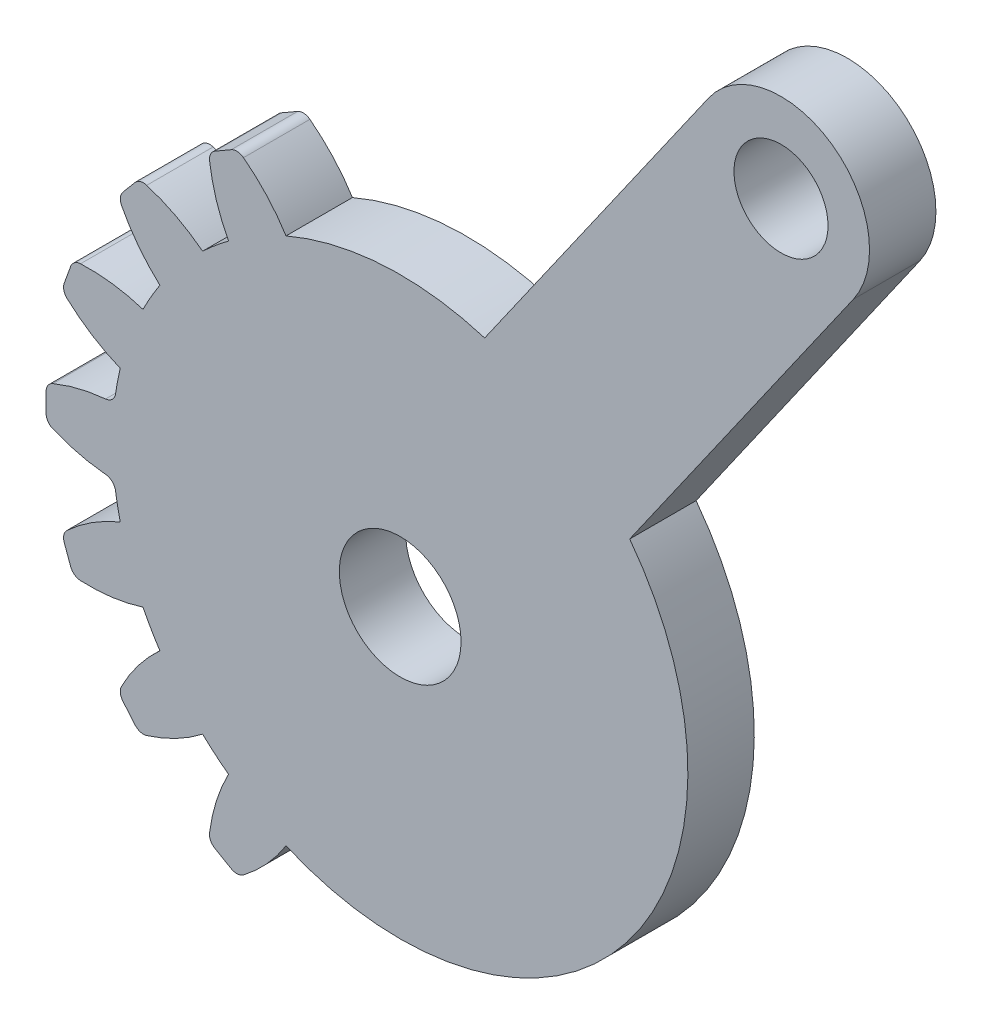
from build123d import *

# Parameters (mm, degrees)
SKETCH1_R           = 13
SKETCH1_R_2         = 2.75
BOSS_EXTRUDE1_DEPTH = 3
BOSS_EXTRUDE2_START = -3
BOSS_EXTRUDE2_DEPTH = 3
FILLET1_R           = 0.5
CIRPATTERN1_COUNT   = 4
CIRPATTERN1_ANGLE   = 60
CIRPATTERN2_COUNT   = 4
CIRPATTERN2_ANGLE   = 60
SKETCH3_R           = 2.125
BOSS_EXTRUDE3_DEPTH = 3
FILLET2_R           = 0.5


with BuildPart() as part:
    # Sketch1 → Boss-Extrude1 (new body)
    with BuildSketch(Plane.XY):
        with Locations((43.95, -5.65)):
            Circle(SKETCH1_R)
        with Locations((43.95, -5.65)):
            Circle(SKETCH1_R_2, mode=Mode.SUBTRACT)
    extrude(amount=BOSS_EXTRUDE1_DEPTH)

    # Sketch2 → Boss-Extrude2 (add)
    with BuildSketch(Plane.XY.offset(3).offset(BOSS_EXTRUDE2_START)):
        with BuildLine():
            Line((27.95, -4.9), (27.95, -6.4))
            ThreePointArc((27.95, -6.4), (29.455813765, -6.929754851), (31.03682843, -7.15))
            ThreePointArc((31.03682843, -7.15), (30.95, -5.65), (31.03682843, -4.15))
            ThreePointArc((31.03682843, -4.15), (29.455813765, -4.370245149), (27.95, -4.9))
        make_face()
    boss_extrude2 = extrude(amount=BOSS_EXTRUDE2_DEPTH)

    # Fillet1
    fillet1_edges = [part.edges().sort_by_distance(p)[0] for p in [
        (31.03682843, -7.15, 1.5),
        (27.95, -6.4, 1.5),
        (27.95, -4.9, 1.5),
        (31.03682843, -4.15, 1.5),
    ]]
    fillet(fillet1_edges, radius=FILLET1_R)

    # CirPattern1: Boss-Extrude2 ×4 about axis
    cirpattern1_axis = Axis((43.95, -5.65, 0), (0, 0, -1))
    for i in range(1, CIRPATTERN1_COUNT):
        add(boss_extrude2.rotate(cirpattern1_axis, i * CIRPATTERN1_ANGLE / (CIRPATTERN1_COUNT - 1)))

    # CirPattern2: Boss-Extrude2 ×4 about axis
    cirpattern2_axis = Axis((43.95, -5.65, 0), (0, 0, 1))
    for i in range(1, CIRPATTERN2_COUNT):
        add(boss_extrude2.rotate(cirpattern2_axis, i * CIRPATTERN2_ANGLE / (CIRPATTERN2_COUNT - 1)))

    # Sketch3 → Boss-Extrude3 (add)
    with BuildSketch(Plane.XY.offset(3)):
        with BuildLine():
            Line((43.799969992, 1.109522125), (57.880684913, 21.218867074))
            ThreePointArc((57.880684913, 21.218867074), (63.451598836, 22.201169506), (64.433901268, 16.630255583))
            Line((64.433901268, 16.630255583), (49.86779594, -4.172298707))
            Line((49.86779594, -4.172298707), (43.799969992, 1.109522125))
        make_face()
        with Locations((61.157293091, 18.924561329)):
            Circle(SKETCH3_R, mode=Mode.SUBTRACT)
    extrude(amount=-BOSS_EXTRUDE3_DEPTH)

    # Fillet2
    fillet2_edges = [part.edges().sort_by_distance(p)[0] for p in [
        (36.599519053, -19.881406461, 1.5),
        (35.300480947, -19.131406461, 1.5),
        (28.65840296, -0.882447172, 1.5),
        (29.171433175, 0.527091759, 1.5),
        (31.211198203, 4.060068423, 1.5),
        (32.175379617, 5.209135087, 1.5),
        (35.300480947, 7.831406461, 1.5),
        (36.599519053, 8.581406461, 1.5),
        (29.171433175, -11.827091759, 1.5),
        (28.65840296, -10.417552828, 1.5),
        (32.175379617, -16.509135087, 1.5),
        (31.211198203, -15.360068423, 1.5),
    ]]
    fillet(fillet2_edges, radius=FILLET2_R)


solid = part.part
